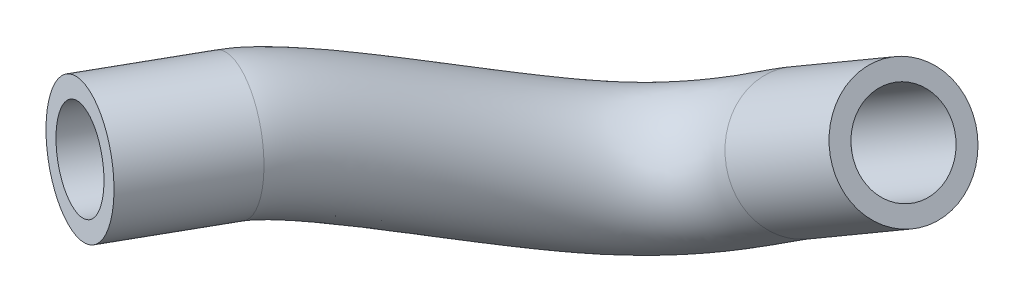
from build123d import *

# Parameters (mm, degrees)
SWEEP1_PROFILE_R     = 13.49375
CUT_SWEEP1_PROFILE_R = 9.525


with BuildPart() as part:
    # Sweep1: sweep along a curve in space
    with BuildLine() as sweep1_path:
        Line((-8.408206143, 71.687934317, 109.952487853), (1.251752114, 69.407807062, 86.572021087))
        add(Edge.make_bspline(
            [(1.251752114, 69.407807062, 86.572021087), (5.952771177, 68.298183044, 75.193916022), (26.837210748, 38.673709591, 21.843422452), (51.337829004, 56.050102517, 17.510139128), (58.640818132, 60.732068928, 18.509664161)],
            knots=[0, 0, 0, 0, 0.528449164, 1, 1, 1, 1], degree=3))
        Line((58.640818132, 60.732068928, 18.509664161), (85.193871243, 77.755304291, 22.14385296))
    # Sweep1 profile (on start of the path) → Sweep1 (sweep)
    with BuildSketch(Plane(origin=(-8.408206143, 71.687934317, 109.952487853), x_dir=(-0.9242222428192053, 0, -0.38185500635481817), z_dir=(0.3803133171856689, -0.08976878959768154, -0.9204908175454006))):
        Circle(SWEEP1_PROFILE_R)
    sweep(path=sweep1_path.line)

    # Cut-Sweep1: sweep along a curve in space
    with BuildLine() as cut_sweep1_path:
        Line((-8.408206143, 71.687934317, 109.952487853), (1.251752114, 69.407807062, 86.572021087))
        add(Edge.make_bspline(
            [(1.251752114, 69.407807062, 86.572021087), (5.952771177, 68.298183044, 75.193916022), (26.837210748, 38.673709591, 21.843422452), (51.337829004, 56.050102517, 17.510139128), (58.640818132, 60.732068928, 18.509664161)],
            knots=[0, 0, 0, 0, 0.528449164, 1, 1, 1, 1], degree=3))
        Line((58.640818132, 60.732068928, 18.509664161), (85.193871243, 77.755304291, 22.14385296))
    # Cut-Sweep1 profile (on start of the path) → Cut-Sweep1 (sweep, cut)
    with BuildSketch(Plane(origin=(-8.408206143, 71.687934317, 109.952487853), x_dir=(-0.9242222428192053, 0, -0.38185500635481817), z_dir=(0.3803133171856689, -0.08976878959768154, -0.9204908175454006))):
        Circle(CUT_SWEEP1_PROFILE_R)
    sweep(path=cut_sweep1_path.line, mode=Mode.SUBTRACT)


solid = part.part
